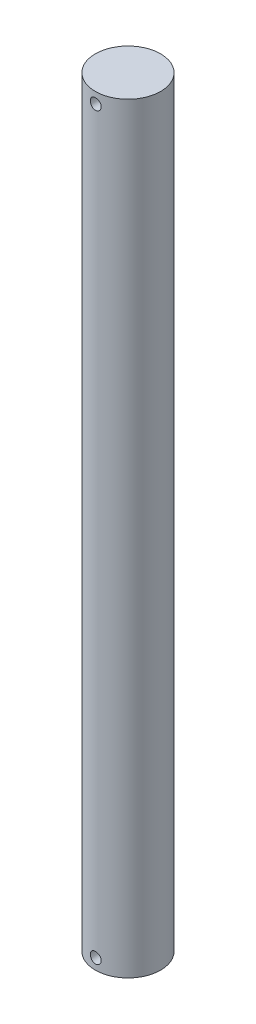
from build123d import *

# Parameters (mm, degrees)
SKETCH1_R               = 30
BOSS_EXTRUDE1_DEPTH     = 700
CUT_EXTRUDE1_DEPTH      = 702.284535691
CUT_EXTRUDE1_DEPTH_BACK = 702.284535691
SKETCH2_R               = 5


with BuildPart() as part:
    # Sketch1 → Boss-Extrude1 (new body)
    with BuildSketch(Plane(origin=(0, 0, 0), x_dir=(1, 0, 0), z_dir=(0, 1, 0))):
        with Locations(Location((0, 0, 0), (0, 0, 270))):
            Circle(SKETCH1_R)
    extrude(amount=BOSS_EXTRUDE1_DEPTH)

    # Sketch2 → Cut-Extrude1 (cut, two sides: drawn at the far end of the back side and taken through both)
    with BuildSketch(Plane.XY.offset(-CUT_EXTRUDE1_DEPTH_BACK)):
        with Locations((0, 690)):
            Circle(SKETCH2_R)
        with Locations((0, 10)):
            Circle(SKETCH2_R)
    extrude(amount=CUT_EXTRUDE1_DEPTH + CUT_EXTRUDE1_DEPTH_BACK, mode=Mode.SUBTRACT)


solid = part.part
